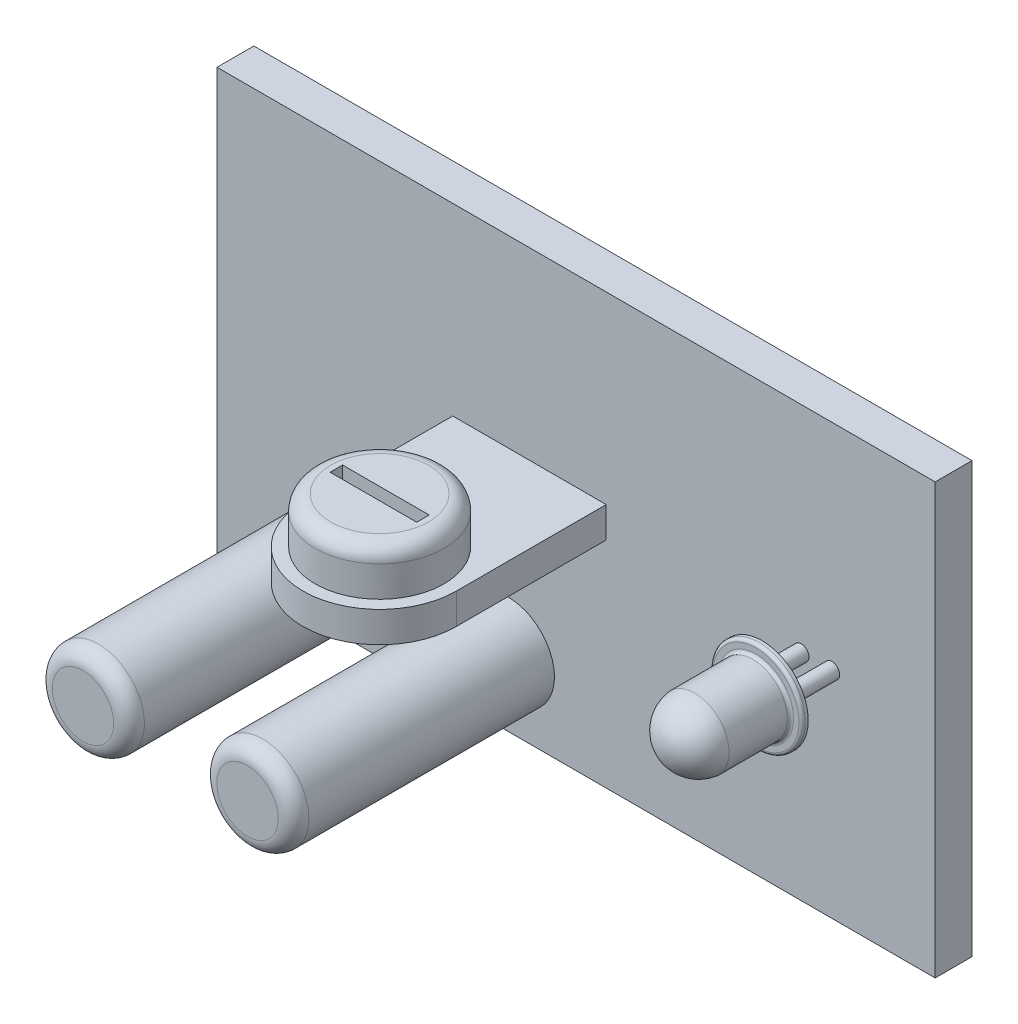
from build123d import *

# Parameters (mm, degrees)
SKETCH_1_W          = 23.4
SKETCH_1_H          = 14
EXTRUDE_1_DEPTH     = 1.2
SKETCH_5_R          = 0.25
EXTRUDE_3_DEPTH     = 2
SKETCH_6_R          = 1.5
EXTRUDE_4_DEPTH     = 0.2
SKETCH_7_R          = 1.121766596
EXTRUDE_5_DEPTH     = 2
DOME_1_FACE_RADIUS  = 1.121766596
DOME_1_HEIGHT       = 1
FILLET_1_R          = 0.1
EXTRUDE_6_DEPTH     = 1
SKETCH_9_R          = 2.098614602
EXTRUDE_7_DEPTH     = 1.5
FILLET_2_R          = 0.5
SKETCH_10_W         = 2.821024734
SKETCH_10_H         = 0.406660996
CUT_EXTRUDE_1_DEPTH = 0.5
SKETCH_11_R         = 1.5
EXTRUDE_8_DEPTH     = 8.5
FILLET_3_R          = 0.5


with BuildPart() as part:
    # Эскиз1 → Бобышка-Вытянуть1 (new body)
    with BuildSketch(Plane.XY):
        with Locations((11.7, 7)):
            Rectangle(SKETCH_1_W, SKETCH_1_H)
    extrude(amount=EXTRUDE_1_DEPTH)

    # Эскиз5 → Бобышка-Вытянуть3 (add)
    with BuildSketch(Plane.XY.offset(1.2)):
        with Locations(Location((20.037318808, 7, 0), (0, 0, 180))):
            Circle(SKETCH_5_R)
        with Locations(Location((19.037318808, 7, 0), (0, 0, 180))):
            Circle(SKETCH_5_R)
    extrude(amount=EXTRUDE_3_DEPTH)

    # Эскиз6 → Бобышка-Вытянуть4 (add)
    with BuildSketch(Plane.XY.offset(3)):
        with Locations((19.563312514, 7)):
            Circle(SKETCH_6_R)
    extrude(amount=EXTRUDE_4_DEPTH)

    # Эскиз7 → Бобышка-Вытянуть5 (add)
    with BuildSketch(Plane.XY.offset(3.2)):
        with Locations((19.563312514, 7)):
            Circle(SKETCH_7_R)
    extrude(amount=EXTRUDE_5_DEPTH)

    # Купол1: a dome of height H over a round flat face of radius A is a cap of a sphere of radius (A * A + H * H) / (2 * H)
    dome_1_r = (DOME_1_FACE_RADIUS * DOME_1_FACE_RADIUS + DOME_1_HEIGHT * DOME_1_HEIGHT) / (2 * DOME_1_HEIGHT)
    dome_1_base = Plane((19.563312514, 7, 5.2), z_dir=(0, 0, 1))
    with Locations(dome_1_base.offset(DOME_1_HEIGHT - dome_1_r)):
        dome_1_ball = Sphere(dome_1_r, mode=Mode.PRIVATE)
    add(split(dome_1_ball, bisect_by=dome_1_base, keep=Keep.TOP, mode=Mode.PRIVATE))

    # Скругление1
    fillet_1_edges = [part.edges().sort_by_distance(p)[0] for p in [
        (18.063312514, 7, 3.2),
        (18.441545917, 7, 3.2),
    ]]
    fillet(fillet_1_edges, radius=FILLET_1_R)

    # Эскиз8 → Бобышка-Вытянуть6 (add)
    with BuildSketch(Plane(origin=(0, 7, 0), x_dir=(-1, 0, 0), z_dir=(0, 1, 0))):
        with BuildLine():
            Line((-12.679803448, 1.2), (-12.679803448, 6.081401921))
            ThreePointArc((-12.679803448, 6.081401921), (-10.179803448, 8.581401921), (-7.679803448, 6.081401921))
            Line((-7.679803448, 6.081401921), (-7.679803448, 1.2))
            Line((-7.679803448, 1.2), (-12.679803448, 1.2))
        make_face()
    extrude(amount=EXTRUDE_6_DEPTH)

    # Эскиз9 → Бобышка-Вытянуть7 (add)
    with BuildSketch(Plane(origin=(0, 8, 0), x_dir=(1, 0, 0), z_dir=(0, 1, 0))):
        with Locations(Location((10.179803448, -6.081401921, 0), (0, 0, 90))):
            Circle(SKETCH_9_R)
    extrude(amount=EXTRUDE_7_DEPTH)

    # Скругление2
    fillet_2_edges = [part.edges().sort_by_distance(p)[0] for p in [
        (10.179803448, 9.5, 8.180016523),
    ]]
    fillet(fillet_2_edges, radius=FILLET_2_R)

    # Эскиз10 → Вырез-Вытянуть1 (cut)
    with BuildSketch(Plane(origin=(0, 9.5, 0), x_dir=(1, 0, 0), z_dir=(0, 1, 0))):
        with Locations((10.179803448, -6.081401921)):
            Rectangle(SKETCH_10_W, SKETCH_10_H)
    extrude(amount=-CUT_EXTRUDE_1_DEPTH, mode=Mode.SUBTRACT)

    # Эскиз11 → Бобышка-Вытянуть8 (add)
    with BuildSketch(Plane.XY.offset(1.2)):
        with Locations(Location((4.133843488, 2.292422246, 0), (0, 0, 180))):
            Circle(SKETCH_11_R)
        with Locations(Location((9.492802765, 2.292422246, 0), (0, 0, 180))):
            Circle(SKETCH_11_R)
    extrude(amount=EXTRUDE_8_DEPTH)

    # Скругление3
    fillet_3_edges = [part.edges().sort_by_distance(p)[0] for p in [
        (5.633843488, 2.292422246, 9.7),
        (10.992802765, 2.292422246, 9.7),
    ]]
    fillet(fillet_3_edges, radius=FILLET_3_R)


solid = part.part
